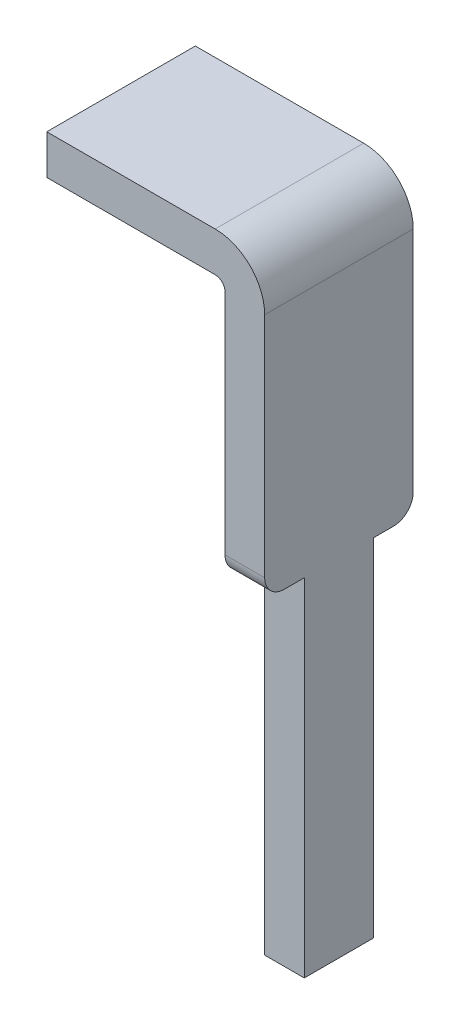
from build123d import *

# Parameters (mm, degrees)
BOSS_EXTRUDE1_DEPTH = 1.5
SKETCH3_W           = 0.4
SKETCH3_H           = 3.5
CUT_EXTRUDE1_DEPTH  = 1.5
FILLET2_R           = 0.2
SKETCH4_W           = 1.5
SKETCH4_H           = 0.4
CUT_EXTRUDE2_DEPTH  = 1.3


with BuildPart() as part:
    # Sketch2 → Boss-Extrude1 (new body)
    with BuildSketch(Plane.XY):
        with BuildLine():
            Line((0, 0), (3, 0))
            ThreePointArc((3, 0), (3.353553391, -0.146446609), (3.5, -0.5))
            Line((3.5, -0.5), (3.5, -6.5))
            Line((3.5, -6.5), (3.1, -6.5))
            Line((3.1, -6.5), (3.1, -0.5))
            ThreePointArc((3.1, -0.5), (3.070710678, -0.429289322), (3, -0.4))
            Line((3, -0.4), (0, -0.4))
            Line((0, -0.4), (0, 0))
        make_face()
    extrude(amount=BOSS_EXTRUDE1_DEPTH)

    # Sketch3 → Cut-Extrude1 (cut)
    with BuildSketch(Plane(origin=(3.5, 0, 0), x_dir=(0, 0, -1), z_dir=(1, 0, 0))):
        with Locations((-0.2, -4.75)):
            Rectangle(SKETCH3_W, SKETCH3_H)
        with Locations((-1.3, -4.75)):
            Rectangle(SKETCH3_W, SKETCH3_H)
    extrude(amount=-CUT_EXTRUDE1_DEPTH, mode=Mode.SUBTRACT)

    # Fillet2
    fillet2_edges = [part.edges().sort_by_distance(p)[0] for p in [
        (3.3, -3, 1.5),
        (3.3, -3, 0),
    ]]
    fillet(fillet2_edges, radius=FILLET2_R)

    # Sketch4 → Cut-Extrude2 (cut)
    with BuildSketch(Plane.ZY):
        with Locations((0.75, -0.2)):
            Rectangle(SKETCH4_W, SKETCH4_H)
    extrude(amount=-CUT_EXTRUDE2_DEPTH, mode=Mode.SUBTRACT)


solid = part.part
